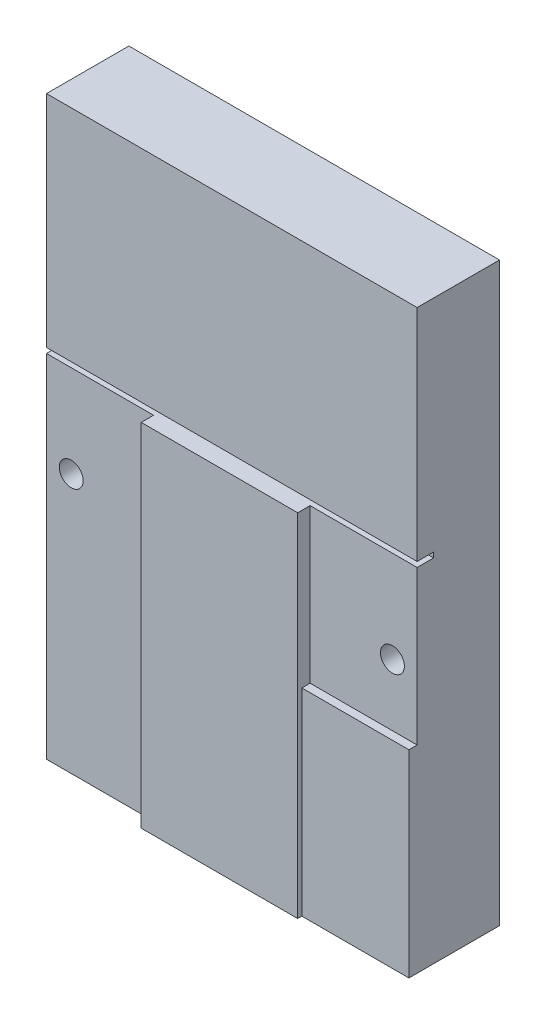
from build123d import *

# Parameters (mm, degrees)
SKETCH2_W           = 45
SKETCH2_H           = 10
BOSS_EXTRUDE1_DEPTH = 40
SKETCH4_W           = 45
SKETCH4_H           = 10
BOSS_EXTRUDE2_DEPTH = 10
SKETCH8_W           = 45
SKETCH8_H           = 10
BOSS_EXTRUDE3_DEPTH = 20
SKETCH9_R           = 1.45
CUT_EXTRUDE2_DEPTH  = 20
SKETCH10_W          = 45
SKETCH10_H          = 0.626165357
CUT_EXTRUDE3_DEPTH  = 2
SKETCH11_W          = 19
SKETCH11_H          = 42.671327575
BOSS_EXTRUDE4_DEPTH = 1.5
SKETCH12_W          = 13
SKETCH12_H          = 24
BOSS_EXTRUDE5_DEPTH = 1


with BuildPart() as part:
    # Sketch2 → Boss-Extrude1 (new body)
    with BuildSketch(Plane(origin=(0, 0, 0), x_dir=(1, 0, 0), z_dir=(0, 1, 0))):
        Rectangle(SKETCH2_W, SKETCH2_H)
    extrude(amount=BOSS_EXTRUDE1_DEPTH)

    # Sketch4 → Boss-Extrude2 (add)
    with BuildSketch(Plane(origin=(0, 40, 0), x_dir=(1, 0, 0), z_dir=(0, 1, 0))):
        Rectangle(SKETCH4_W, SKETCH4_H)
    extrude(amount=BOSS_EXTRUDE2_DEPTH)

    # Sketch8 → Boss-Extrude3 (add)
    with BuildSketch(Plane.XZ):
        Rectangle(SKETCH8_W, SKETCH8_H)
    extrude(amount=BOSS_EXTRUDE3_DEPTH)

    # Sketch9 → Cut-Extrude2 (cut)
    with BuildSketch(Plane.XY.offset(5)):
        with Locations((19.5, 11.5)):
            Circle(SKETCH9_R)
        with Locations((-19.5, 11.5)):
            Circle(SKETCH9_R)
    extrude(amount=-CUT_EXTRUDE2_DEPTH, mode=Mode.SUBTRACT)

    # Sketch10 → Cut-Extrude3 (cut)
    with BuildSketch(Plane.XY.offset(5)):
        with Locations((0, 22.984410254)):
            Rectangle(SKETCH10_W, SKETCH10_H)
    extrude(amount=-CUT_EXTRUDE3_DEPTH, mode=Mode.SUBTRACT)

    # Sketch11 → Boss-Extrude4 (add)
    with BuildSketch(Plane.XY.offset(5)):
        with Locations((0, 1.335663788)):
            Rectangle(SKETCH11_W, SKETCH11_H)
    extrude(amount=BOSS_EXTRUDE4_DEPTH)

    # Sketch12 → Boss-Extrude5 (add)
    with BuildSketch(Plane.XY.offset(5)):
        with Locations((16, -8)):
            Rectangle(SKETCH12_W, SKETCH12_H)
    extrude(amount=BOSS_EXTRUDE5_DEPTH)


solid = part.part
